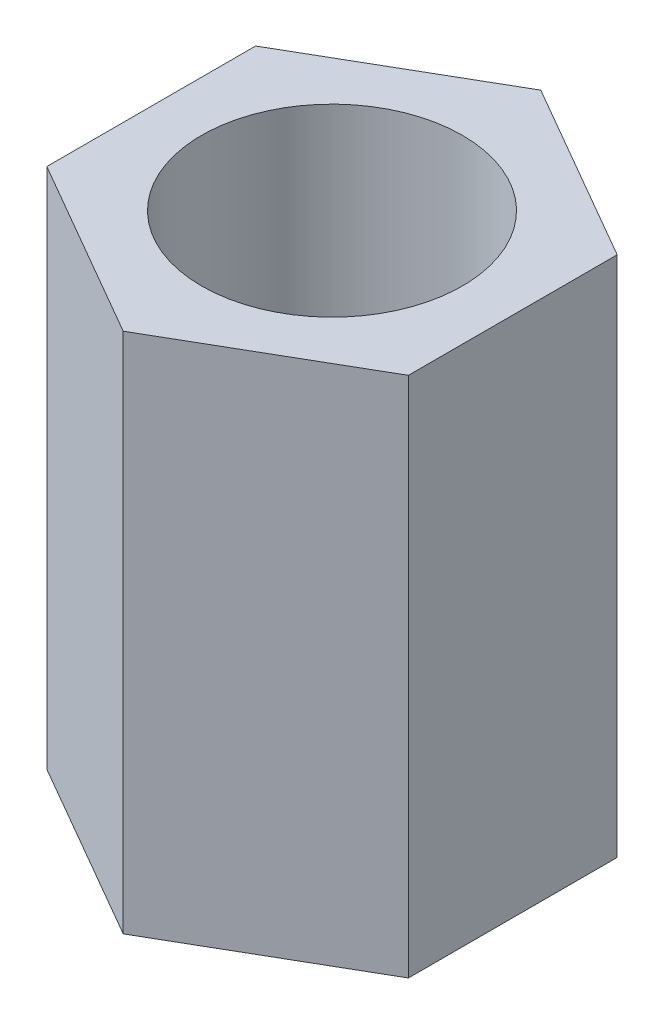
from build123d import *

# Parameters (mm, degrees)
SKETCH_1_R      = 1.25
EXTRUDE_1_DEPTH = 5


with BuildPart() as part:
    # 草图1 → 凸台-拉伸1 (new body)
    with BuildSketch(Plane(origin=(0, 0, 0), x_dir=(1, 0, 0), z_dir=(0, 1, 0))):
        Polygon((0, 2), (-1.732050808, 1), (-1.732050808, -1), (0, -2), (1.732050808, -1), (1.732050808, 1), align=None)
        with Locations(Location((0, 0, 0), (0, 0, 270))):
            Circle(SKETCH_1_R, mode=Mode.SUBTRACT)
    extrude(amount=EXTRUDE_1_DEPTH)


solid = part.part
